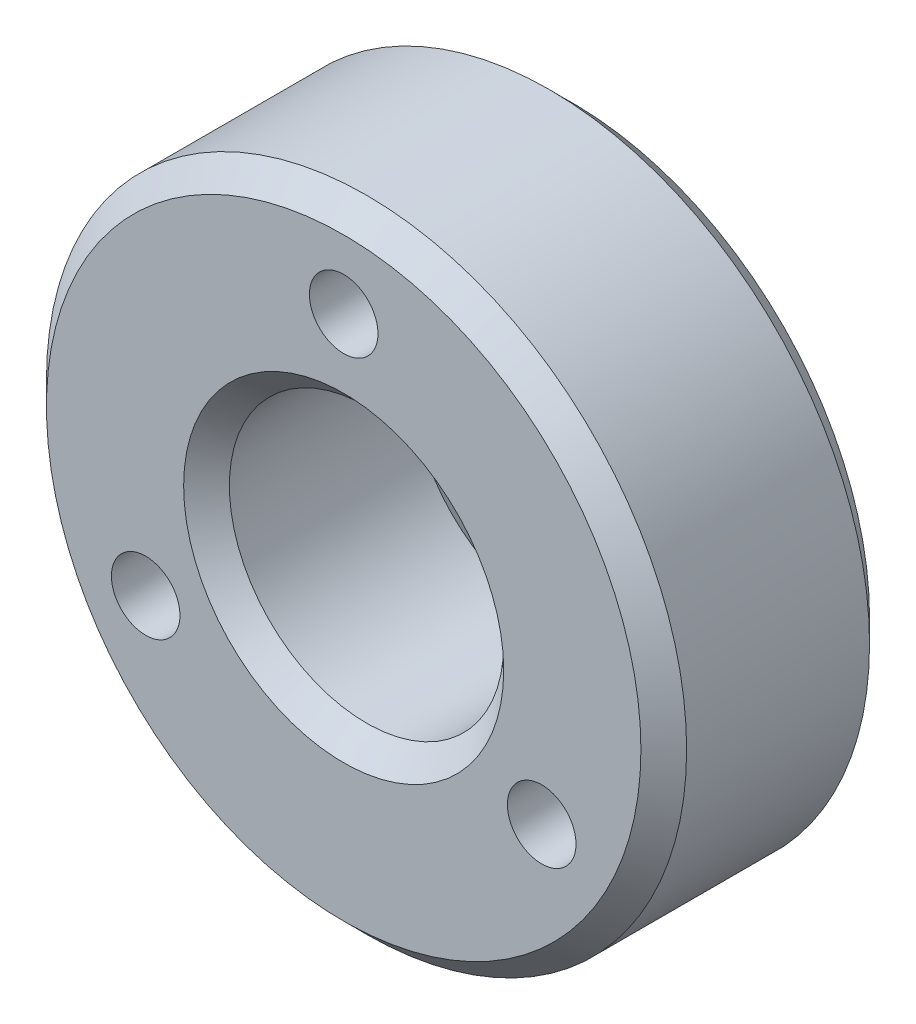
from build123d import *

# Parameters (mm, degrees)
SKETCH1_R           = 14
SKETCH1_R_2         = 6
SKETCH1_R_3         = 1.5
BOSS_EXTRUDE1_DEPTH = 10
CHAMFER1_SIZE       = 1


with BuildPart() as part:
    # Sketch1 → Boss-Extrude1 (new body)
    with BuildSketch(Plane.XY):
        Circle(SKETCH1_R)
        Circle(SKETCH1_R_2, mode=Mode.SUBTRACT)
        with Locations((0, 10)):
            Circle(SKETCH1_R_3, mode=Mode.SUBTRACT)
        with Locations((8.660254038, -5)):
            Circle(SKETCH1_R_3, mode=Mode.SUBTRACT)
        with Locations((-8.660254038, -5)):
            Circle(SKETCH1_R_3, mode=Mode.SUBTRACT)
    extrude(amount=BOSS_EXTRUDE1_DEPTH)

    # Chamfer1
    chamfer1_edges = [part.edges().sort_by_distance(p)[0] for p in [
        (-14, 0, 0),
        (-14, 0, 10),
        (-6, 0, 0),
        (-6, 0, 10),
    ]]
    chamfer(chamfer1_edges, length=CHAMFER1_SIZE)


solid = part.part
